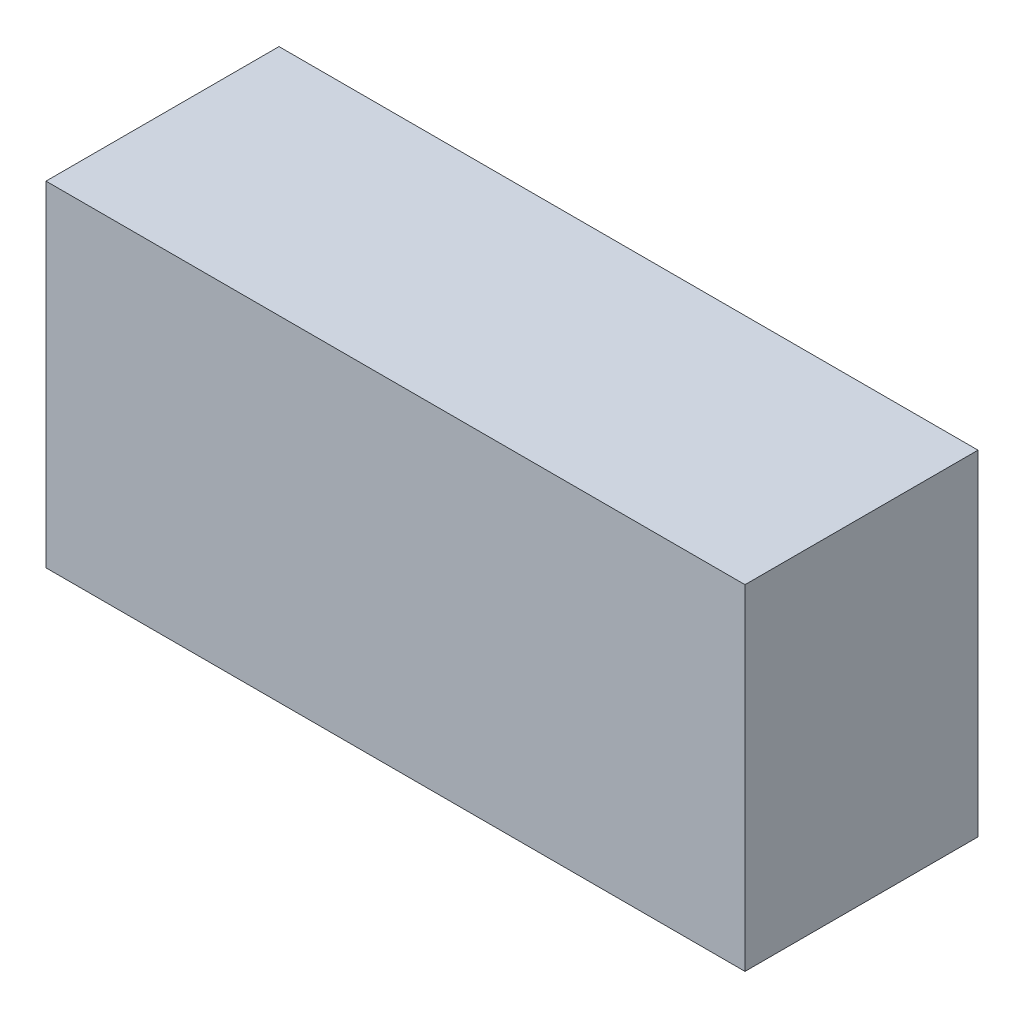
from build123d import *

# Parameters (mm, degrees)
SKETCH_1_W          = 480
SKETCH_1_H          = 230
EXTRUDE_1_DEPTH     = 160
CUT_EXTRUDE_1_DEPTH = 5


with BuildPart() as part:
    # 스케치1 → 보스-돌출1 (new body)
    with BuildSketch(Plane.XY):
        Rectangle(SKETCH_1_W, SKETCH_1_H)
    extrude(amount=EXTRUDE_1_DEPTH)

    # 스케치3 → 컷-돌출1 (cut)
    # profile 1 of 8: a face of its own
    with BuildSketch(Plane(origin=(0, -115, 0), x_dir=(-1, 0, 0), z_dir=(0, -1, 0))):
        with BuildLine():
            add(Edge.make_bspline(
                [(-65.042999138, -97.573485167), (-64.672667104, -97.582865049), (-63.945304436, -97.601287911), (-62.87630502, -97.74231136), (-61.855761619, -97.986285017), (-60.875360826, -98.311216346), (-59.946829531, -98.744669976), (-59.063178717, -99.26858511), (-58.226510866, -99.888450588), (-57.448102972, -100.599474742), (-56.735777542, -101.373094478), (-56.108201049, -102.198682536), (-55.582245085, -103.071247121), (-55.150326301, -103.988166153), (-54.811477102, -104.94736597), (-54.577653996, -105.953960271), (-54.428293138, -107.001427072), (-54.410831552, -107.715866299), (-54.401973497, -108.078292859)],
                knots=[0, 0, 0, 0, 1.065120563, 2.091984664, 3.0946048, 4.079830382, 5.057816894, 6.036188127, 7.030412546, 8.04752943, 9.064399622, 10.05169764, 11.02544977, 11.989514704, 12.962713494, 13.945757189, 14.957906945, 16, 16, 16, 16], degree=3))
            add(Edge.make_bspline(
                [(-54.401973497, -108.078292859), (-54.410830254, -108.438049696), (-54.428287949, -109.147172098), (-54.577823821, -110.187991779), (-54.81234382, -111.188510045), (-55.147179627, -112.147056632), (-55.577039504, -113.064642711), (-56.106497625, -113.938853876), (-56.730161686, -114.769976724), (-57.439915121, -115.548906239), (-58.213635361, -116.2631775), (-59.0435226, -116.885571076), (-59.910912999, -117.421137502), (-60.826968475, -117.848472782), (-61.779540114, -118.190026613), (-62.777153388, -118.422898784), (-63.815133697, -118.57311046), (-64.522968005, -118.590359123), (-64.882742728, -118.599126193)],
                knots=[0, 0, 0, 0, 1.043624062, 2.057103931, 3.04512605, 4.022047818, 4.998200453, 5.980619268, 6.982898556, 8.009068085, 9.034988726, 10.034168286, 11.015286542, 11.987931943, 12.962482838, 13.94673481, 14.956375938, 16, 16, 16, 16], degree=3))
            add(Edge.make_bspline(
                [(-64.882742728, -118.599126193), (-65.245167408, -118.590272553), (-65.959602927, -118.572819674), (-67.008385987, -118.423211646), (-68.01568738, -118.189261339), (-68.97862653, -117.854921703), (-69.897740413, -117.422823242), (-70.7748266, -116.895941076), (-71.606364584, -116.270757412), (-72.385460279, -115.561234129), (-73.09831284, -114.78882526), (-73.719794986, -113.961200945), (-74.246795634, -113.094598336), (-74.677443248, -112.186612484), (-75.018383016, -111.241632811), (-75.250981977, -110.253355797), (-75.401473131, -109.227415764), (-75.418815111, -108.528884916), (-75.427614523, -108.174446705)],
                knots=[0, 0, 0, 0, 1.053102029, 2.075944431, 3.073151272, 4.055350789, 5.033113405, 6.020478099, 7.024410459, 8.052272461, 9.079885166, 10.07527673, 11.055994387, 12.023226415, 12.992069828, 13.970394897, 14.97016774, 16, 16, 16, 16], degree=3))
            add(Edge.make_bspline(
                [(-75.427614523, -108.174446705), (-75.424559463, -107.936545739), (-75.418487884, -107.463745033), (-75.345392498, -106.761650175), (-75.239325634, -106.070846416), (-75.087314705, -105.393298142), (-74.888505179, -104.730663944), (-74.653922166, -104.078373871), (-74.367408764, -103.443038306), (-74.043519346, -102.821647497), (-73.682023301, -102.223888035), (-73.282733304, -101.658861845), (-72.859674055, -101.121827578), (-72.395883235, -100.626701842), (-71.906646405, -100.159080948), (-71.384027101, -99.726151137), (-70.831214276, -99.32400856), (-70.245829249, -98.961606611), (-69.64229625, -98.633840127), (-69.020143234, -98.352572407), (-68.387819968, -98.111166341), (-67.742364837, -97.915504483), (-67.085491854, -97.761035706), (-66.415767371, -97.655850828), (-65.733724935, -97.582569011), (-65.274231684, -97.576526143), (-65.042999138, -97.573485167)],
                knots=[0, 0, 0, 0, 1.037015668, 2.060948919, 3.074880161, 4.083647147, 5.086022904, 6.090072063, 7.104153813, 8.122640571, 9.144368836, 10.147691507, 11.138137339, 12.123020368, 13.103399296, 14.087645067, 15.080126199, 16.082011238, 17.087798457, 18.072939717, 19.057185487, 20.037253025, 21.01195951, 21.997135196, 22.992090687, 24, 24, 24, 24], degree=3))
        make_face()
        with BuildLine():
            add(Edge.make_bspline(
                [(-64.954858112, -99.624767218), (-65.144656018, -99.627080877), (-65.522437349, -99.631686075), (-66.084063271, -99.692347307), (-66.638302893, -99.778803815), (-67.185270677, -99.902126791), (-67.722678044, -100.07014995), (-68.25553428, -100.263526568), (-68.778980302, -100.499075657), (-69.291288061, -100.765205397), (-69.787945633, -101.059770658), (-70.256589642, -101.385323613), (-70.698433321, -101.734229637), (-71.112394845, -102.107302994), (-71.497258686, -102.506443575), (-71.860599837, -102.925600353), (-72.18785459, -103.376754016), (-72.487772171, -103.847670627), (-72.75615983, -104.337736805), (-72.994819, -104.841793161), (-73.190041907, -105.363951371), (-73.349255486, -105.898546557), (-73.481254405, -106.444732041), (-73.564876829, -107.006651177), (-73.626204597, -107.581480389), (-73.630546571, -107.969948126), (-73.632742728, -108.166433885)],
                knots=[0, 0, 0, 0, 1.008559885, 2.007477868, 2.99961109, 3.989939068, 4.984837346, 5.991145699, 7.001802488, 8.033829008, 9.059044045, 10.069351652, 11.065060232, 12.050310815, 13.029377138, 14.011219647, 14.996725999, 15.989392538, 16.977580475, 17.965360261, 18.951710183, 19.937753436, 20.929683414, 21.935841486, 22.955955122, 24, 24, 24, 24], degree=3))
            add(Edge.make_bspline(
                [(-73.632742728, -108.166433885), (-73.625457802, -108.455360861), (-73.6111261, -109.023769605), (-73.485654271, -109.856730427), (-73.292385846, -110.657234921), (-73.007486609, -111.420902974), (-72.651197382, -112.154298876), (-72.211043724, -112.850916617), (-71.689563235, -113.51094447), (-71.097200225, -114.129774579), (-70.449641902, -114.694607746), (-69.762026302, -115.190398652), (-69.041719974, -115.609885794), (-68.28684453, -115.951629065), (-67.501430021, -116.222427567), (-66.680415444, -116.408019745), (-65.82926996, -116.530165204), (-65.249094788, -116.541895238), (-64.954858112, -116.547844141)],
                knots=[0, 0, 0, 0, 1.032063989, 2.030389145, 3.003944642, 3.970395727, 4.937377036, 5.913328081, 6.909231446, 7.93887556, 8.970685674, 9.976071282, 10.964166581, 11.944589148, 12.933237628, 13.927779006, 14.949070134, 16, 16, 16, 16], degree=3))
            add(Edge.make_bspline(
                [(-64.954858112, -116.547844141), (-64.757089532, -116.545126973), (-64.364855038, -116.539738014), (-63.781452053, -116.48545986), (-63.208559415, -116.398420606), (-62.646980673, -116.273102574), (-62.097353179, -116.116261395), (-61.557382876, -115.929931521), (-61.032821217, -115.6974675), (-60.517050715, -115.440622062), (-60.023357905, -115.147821162), (-59.552069149, -114.83331745), (-59.11506355, -114.484925331), (-58.701411713, -114.117394974), (-58.314967776, -113.723315843), (-57.958345009, -113.30320029), (-57.632744254, -112.854396534), (-57.332940559, -112.384194216), (-57.065493344, -111.892787058), (-56.83246992, -111.386903184), (-56.63477783, -110.867788273), (-56.475186374, -110.334693579), (-56.350126593, -109.788631586), (-56.263955622, -109.228871139), (-56.20367883, -108.656532039), (-56.199135531, -108.269424291), (-56.196845292, -108.074286449)],
                knots=[0, 0, 0, 0, 1.047197238, 2.076906641, 3.100256066, 4.114471768, 5.12198147, 6.126382909, 7.136867548, 8.15857795, 9.17633901, 10.174870724, 11.156907918, 12.133735059, 13.104061851, 14.077631395, 15.04955518, 16.038496417, 17.029181396, 18.010275684, 18.986308667, 19.968651475, 20.955262928, 21.950658345, 22.966943676, 24, 24, 24, 24], degree=3))
            add(Edge.make_bspline(
                [(-56.196845292, -108.074286449), (-56.199137366, -107.880483567), (-56.203684117, -107.496039852), (-56.26392683, -106.927692319), (-56.350217632, -106.371959682), (-56.474575963, -105.831023665), (-56.634862556, -105.304746378), (-56.832504444, -104.793622106), (-57.065563298, -104.295746705), (-57.333038866, -103.812350723), (-57.633700714, -103.348495077), (-57.962239248, -102.90505272), (-58.324326951, -102.490351341), (-58.709618522, -102.094153089), (-59.127737867, -101.724908006), (-59.576790976, -101.382493602), (-60.051326277, -101.05864632), (-60.553767623, -100.766500252), (-61.072304501, -100.496704637), (-61.604384261, -100.265556048), (-62.143979116, -100.069143937), (-62.689716901, -99.901618422), (-63.246191063, -99.779286821), (-63.809641513, -99.692269394), (-64.379288705, -99.631707189), (-64.762392818, -99.627087883), (-64.954858112, -99.624767218)],
                knots=[0, 0, 0, 0, 1.02996197, 2.043119294, 3.035359645, 4.018872909, 4.991431989, 5.957985074, 6.929999688, 7.912076566, 8.892894881, 9.867085534, 10.843653904, 11.817741046, 12.803660682, 13.806313499, 14.818574707, 15.856120519, 16.894564902, 17.924820532, 18.937903209, 19.946497019, 20.957711757, 21.963978472, 22.977135795, 24, 24, 24, 24], degree=3))
        make_face(mode=Mode.SUBTRACT)
    # profile 2 of 8: a face of its own
    with BuildSketch(Plane(origin=(0, -115, 0), x_dir=(-1, 0, 0), z_dir=(0, -1, 0))):
        Polygon((-51.32505042, -118.08630568), (-48.684826061, -98.08630568), (-48.428415805, -98.08630568), (-40.171204266, -114.49656209), (-31.934024779, -98.08630568), (-31.673608112, -98.08630568), (-29.017358112, -118.08630568), (-30.820242728, -118.08630568), (-32.73530683, -103.695280039), (-39.954858112, -118.08630568), (-40.359505548, -118.08630568), (-47.607101702, -103.663228757), (-49.518159394, -118.08630568), align=None)
    # profile 3 of 8: a face of its own
    with BuildSketch(Plane(origin=(0, -115, 0), x_dir=(-1, 0, 0), z_dir=(0, -1, 0))):
        with BuildLine():
            add(Edge.make_bspline(
                [(-15.555819651, -97.573485167), (-15.185487617, -97.582865049), (-14.458124949, -97.601287911), (-13.389125533, -97.74231136), (-12.368582132, -97.986285017), (-11.388181338, -98.311216346), (-10.459650044, -98.744669976), (-9.57599923, -99.26858511), (-8.739331379, -99.888450588), (-7.960923485, -100.599474742), (-7.248598054, -101.373094478), (-6.621021562, -102.198682536), (-6.095065597, -103.071247121), (-5.663146814, -103.988166153), (-5.324297615, -104.94736597), (-5.090474508, -105.953960271), (-4.94111365, -107.001427072), (-4.923652065, -107.715866299), (-4.91479401, -108.078292859)],
                knots=[0, 0, 0, 0, 1.065120563, 2.091984664, 3.0946048, 4.079830382, 5.057816894, 6.036188127, 7.030412546, 8.04752943, 9.064399622, 10.05169764, 11.02544977, 11.989514704, 12.962713494, 13.945757189, 14.957906945, 16, 16, 16, 16], degree=3))
            add(Edge.make_bspline(
                [(-4.91479401, -108.078292859), (-4.923650767, -108.438049696), (-4.941108462, -109.147172098), (-5.090644333, -110.187991779), (-5.325164333, -111.188510045), (-5.66000014, -112.147056632), (-6.089860017, -113.064642711), (-6.619318138, -113.938853876), (-7.242982199, -114.769976724), (-7.952735634, -115.548906239), (-8.726455874, -116.2631775), (-9.556343113, -116.885571076), (-10.423733512, -117.421137502), (-11.339788987, -117.848472782), (-12.292360626, -118.190026613), (-13.289973901, -118.422898784), (-14.32795421, -118.57311046), (-15.035788517, -118.590359123), (-15.395563241, -118.599126193)],
                knots=[0, 0, 0, 0, 1.043624062, 2.057103931, 3.04512605, 4.022047818, 4.998200453, 5.980619268, 6.982898556, 8.009068085, 9.034988726, 10.034168286, 11.015286542, 11.987931943, 12.962482838, 13.94673481, 14.956375938, 16, 16, 16, 16], degree=3))
            add(Edge.make_bspline(
                [(-15.395563241, -118.599126193), (-15.757987921, -118.590272553), (-16.47242344, -118.572819674), (-17.521206499, -118.423211646), (-18.528507893, -118.189261339), (-19.491447043, -117.854921703), (-20.410560926, -117.422823242), (-21.287647113, -116.895941076), (-22.119185097, -116.270757412), (-22.898280791, -115.561234129), (-23.611133352, -114.78882526), (-24.232615499, -113.961200945), (-24.759616147, -113.094598336), (-25.190263761, -112.186612484), (-25.531203529, -111.241632811), (-25.76380249, -110.253355797), (-25.914293644, -109.227415764), (-25.931635624, -108.528884916), (-25.940435036, -108.174446705)],
                knots=[0, 0, 0, 0, 1.053102029, 2.075944431, 3.073151272, 4.055350789, 5.033113405, 6.020478099, 7.024410459, 8.052272461, 9.079885166, 10.07527673, 11.055994387, 12.023226415, 12.992069828, 13.970394897, 14.97016774, 16, 16, 16, 16], degree=3))
            add(Edge.make_bspline(
                [(-25.940435036, -108.174446705), (-25.937379975, -107.936545739), (-25.931308396, -107.463745033), (-25.858213011, -106.761650175), (-25.752146147, -106.070846416), (-25.600135218, -105.393298142), (-25.401325692, -104.730663944), (-25.166742679, -104.078373871), (-24.880229277, -103.443038306), (-24.556339859, -102.821647497), (-24.194843813, -102.223888035), (-23.795553817, -101.658861845), (-23.372494568, -101.121827578), (-22.908703747, -100.626701842), (-22.419466918, -100.159080948), (-21.896847614, -99.726151137), (-21.344034789, -99.32400856), (-20.758649762, -98.961606611), (-20.155116763, -98.633840127), (-19.532963747, -98.352572407), (-18.900640481, -98.111166341), (-18.25518535, -97.915504483), (-17.598312367, -97.761035706), (-16.928587883, -97.655850828), (-16.246545448, -97.582569011), (-15.787052196, -97.576526143), (-15.555819651, -97.573485167)],
                knots=[0, 0, 0, 0, 1.037015668, 2.060948919, 3.074880161, 4.083647147, 5.086022904, 6.090072063, 7.104153813, 8.122640571, 9.144368836, 10.147691507, 11.138137339, 12.123020368, 13.103399296, 14.087645067, 15.080126199, 16.082011238, 17.087798457, 18.072939717, 19.057185487, 20.037253025, 21.01195951, 21.997135196, 22.992090687, 24, 24, 24, 24], degree=3))
        make_face()
        with BuildLine():
            add(Edge.make_bspline(
                [(-15.467678625, -99.624767218), (-15.657476531, -99.627080877), (-16.035257862, -99.631686075), (-16.596883784, -99.692347307), (-17.151123406, -99.778803815), (-17.698091189, -99.902126791), (-18.235498557, -100.07014995), (-18.768354793, -100.263526568), (-19.291800815, -100.499075657), (-19.804108574, -100.765205397), (-20.300766146, -101.059770658), (-20.769410154, -101.385323613), (-21.211253834, -101.734229637), (-21.625215358, -102.107302994), (-22.010079199, -102.506443575), (-22.37342035, -102.925600353), (-22.700675102, -103.376754016), (-23.000592684, -103.847670627), (-23.268980343, -104.337736805), (-23.507639513, -104.841793161), (-23.70286242, -105.363951371), (-23.862075999, -105.898546557), (-23.994074918, -106.444732041), (-24.077697342, -107.006651177), (-24.13902511, -107.581480389), (-24.143367084, -107.969948126), (-24.145563241, -108.166433885)],
                knots=[0, 0, 0, 0, 1.008559885, 2.007477868, 2.99961109, 3.989939068, 4.984837346, 5.991145699, 7.001802488, 8.033829008, 9.059044045, 10.069351652, 11.065060232, 12.050310815, 13.029377138, 14.011219647, 14.996725999, 15.989392538, 16.977580475, 17.965360261, 18.951710183, 19.937753436, 20.929683414, 21.935841486, 22.955955122, 24, 24, 24, 24], degree=3))
            add(Edge.make_bspline(
                [(-24.145563241, -108.166433885), (-24.138278315, -108.455360861), (-24.123946613, -109.023769605), (-23.998474784, -109.856730427), (-23.805206358, -110.657234921), (-23.520307122, -111.420902974), (-23.164017895, -112.154298876), (-22.723864236, -112.850916617), (-22.202383747, -113.51094447), (-21.610020738, -114.129774579), (-20.962462415, -114.694607746), (-20.274846815, -115.190398652), (-19.554540487, -115.609885794), (-18.799665043, -115.951629065), (-18.014250534, -116.222427567), (-17.193235957, -116.408019745), (-16.342090473, -116.530165204), (-15.761915301, -116.541895238), (-15.467678625, -116.547844141)],
                knots=[0, 0, 0, 0, 1.032063989, 2.030389145, 3.003944642, 3.970395727, 4.937377036, 5.913328081, 6.909231446, 7.93887556, 8.970685674, 9.976071282, 10.964166581, 11.944589148, 12.933237628, 13.927779006, 14.949070134, 16, 16, 16, 16], degree=3))
            add(Edge.make_bspline(
                [(-15.467678625, -116.547844141), (-15.269910045, -116.545126973), (-14.877675551, -116.539738014), (-14.294272566, -116.48545986), (-13.721379928, -116.398420606), (-13.159801186, -116.273102574), (-12.610173692, -116.116261395), (-12.070203388, -115.929931521), (-11.545641729, -115.6974675), (-11.029871228, -115.440622062), (-10.536178418, -115.147821162), (-10.064889662, -114.83331745), (-9.627884063, -114.484925331), (-9.214232226, -114.117394974), (-8.827788289, -113.723315843), (-8.471165522, -113.30320029), (-8.145564767, -112.854396534), (-7.845761072, -112.384194216), (-7.578313856, -111.892787058), (-7.345290433, -111.386903184), (-7.147598343, -110.867788273), (-6.988006887, -110.334693579), (-6.862947106, -109.788631586), (-6.776776135, -109.228871139), (-6.716499342, -108.656532039), (-6.711956044, -108.269424291), (-6.709665805, -108.074286449)],
                knots=[0, 0, 0, 0, 1.047197238, 2.076906641, 3.100256066, 4.114471768, 5.12198147, 6.126382909, 7.136867548, 8.15857795, 9.17633901, 10.174870724, 11.156907918, 12.133735059, 13.104061851, 14.077631395, 15.04955518, 16.038496417, 17.029181396, 18.010275684, 18.986308667, 19.968651475, 20.955262928, 21.950658345, 22.966943676, 24, 24, 24, 24], degree=3))
            add(Edge.make_bspline(
                [(-6.709665805, -108.074286449), (-6.711957879, -107.880483567), (-6.71650463, -107.496039852), (-6.776747342, -106.927692319), (-6.863038144, -106.371959682), (-6.987396476, -105.831023665), (-7.147683069, -105.304746378), (-7.345324957, -104.793622106), (-7.578383811, -104.295746705), (-7.845859379, -103.812350723), (-8.146521227, -103.348495077), (-8.475059761, -102.90505272), (-8.837147464, -102.490351341), (-9.222439035, -102.094153089), (-9.64055838, -101.724908006), (-10.089611489, -101.382493602), (-10.56414679, -101.05864632), (-11.066588135, -100.766500252), (-11.585125014, -100.496704637), (-12.117204774, -100.265556048), (-12.656799629, -100.069143937), (-13.202537413, -99.901618422), (-13.759011575, -99.779286821), (-14.322462026, -99.692269394), (-14.892109218, -99.631707189), (-15.275213331, -99.627087883), (-15.467678625, -99.624767218)],
                knots=[0, 0, 0, 0, 1.02996197, 2.043119294, 3.035359645, 4.018872909, 4.991431989, 5.957985074, 6.929999688, 7.912076566, 8.892894881, 9.867085534, 10.843653904, 11.817741046, 12.803660682, 13.806313499, 14.818574707, 15.856120519, 16.894564902, 17.924820532, 18.937903209, 19.946497019, 20.957711757, 21.963978472, 22.977135795, 24, 24, 24, 24], degree=3))
        make_face(mode=Mode.SUBTRACT)
    # profile 4 of 8: a face of its own
    with BuildSketch(Plane(origin=(0, -115, 0), x_dir=(-1, 0, 0), z_dir=(0, -1, 0))):
        with BuildLine():
            Line((-0.812229907, -98.08630568), (3.190173939, -98.08630568))
            add(Edge.make_bspline(
                [(3.190173939, -98.08630568), (3.457266102, -98.087194743), (3.970112641, -98.088901842), (4.704817043, -98.098420487), (5.372400455, -98.125702519), (5.972513822, -98.149180139), (6.505146136, -98.191991233), (6.971930655, -98.232909216), (7.370717498, -98.286472992), (7.612122362, -98.336218266), (7.721423939, -98.358741577)],
                knots=[0, 0, 0, 0, 1.410062039, 2.707475311, 3.878576406, 4.937260626, 5.877586885, 6.699081471, 7.410979367, 8, 8, 8, 8], degree=3))
            add(Edge.make_bspline(
                [(7.721423939, -98.358741577), (7.867747505, -98.394894522), (8.157273159, -98.466429172), (8.57413068, -98.617626891), (8.971355388, -98.792596174), (9.347297241, -98.998103147), (9.700073191, -99.235673317), (10.033320681, -99.501205445), (10.3485519, -99.793246621), (10.633018359, -100.119160001), (10.901241511, -100.461082913), (11.127462234, -100.830818667), (11.32247069, -101.217455967), (11.477730787, -101.624926926), (11.602747778, -102.049279908), (11.690897717, -102.494358746), (11.743761647, -102.958135747), (11.749143678, -103.274466654), (11.751872657, -103.434863372)],
                knots=[0, 0, 0, 0, 1.027469482, 2.033020251, 3.019912614, 3.986113645, 4.951240523, 5.91722682, 6.890402269, 7.87763091, 8.8651537, 9.85103654, 10.82876324, 11.815024772, 12.821070561, 13.842952187, 14.906261191, 16, 16, 16, 16], degree=3))
            add(Edge.make_bspline(
                [(11.751872657, -103.434863372), (11.743478382, -103.701349684), (11.727098977, -104.221333501), (11.574384099, -104.975967109), (11.324232558, -105.679906049), (10.979528049, -106.33226398), (10.540559617, -106.920324811), (10.012989382, -107.436841698), (9.39652303, -107.86906977), (8.822641225, -108.168800083), (8.315702941, -108.360759561), (7.898369725, -108.495824469), (7.443129854, -108.600178556), (6.954345085, -108.693665023), (6.429981339, -108.764246134), (5.871295399, -108.81594096), (5.277888819, -108.848249809), (4.870236994, -108.853061266), (4.660526503, -108.855536449)],
                knots=[0, 0, 0, 0, 1.260483769, 2.459530307, 3.627416485, 4.787058657, 5.939039949, 7.08810263, 8.267026773, 9.491475466, 10.141966685, 10.831826277, 11.566392101, 12.351337768, 13.187381173, 14.07005841, 15.007169909, 16, 16, 16, 16], degree=3))
            Line((4.660526503, -108.855536449), (12.008282913, -118.08630568))
            Line((12.008282913, -118.08630568), (9.788731631, -118.08630568))
            Line((9.788731631, -118.08630568), (2.440975221, -108.855536449))
            Line((2.440975221, -108.855536449), (0.982641888, -108.855536449))
            Line((0.982641888, -108.855536449), (0.982641888, -118.08630568))
            Line((0.982641888, -118.08630568), (-0.812229907, -118.08630568))
            Line((-0.812229907, -118.08630568), (-0.812229907, -98.08630568))
        make_face()
        with BuildLine():
            Line((0.982641888, -100.137587731), (0.982641888, -106.804254398))
            Line((0.982641888, -106.804254398), (4.644500862, -106.832299269))
            add(Edge.make_bspline(
                [(4.644500862, -106.832299269), (4.815472513, -106.832374908), (5.146864268, -106.832521516), (5.626296638, -106.809699937), (6.072697276, -106.783738118), (6.484358717, -106.744027573), (6.861464862, -106.69285002), (7.203827223, -106.628832967), (7.512004663, -106.554249752), (7.871424882, -106.43881189), (8.27277649, -106.255920357), (8.708956261, -105.989831793), (9.080398191, -105.655151112), (9.394214547, -105.272445649), (9.646382727, -104.851667084), (9.824165894, -104.39785926), (9.93697985, -103.9224787), (9.950285824, -103.595746655), (9.957000862, -103.430856962)],
                knots=[0, 0, 0, 0, 1.146690395, 2.22261258, 3.21895312, 4.145990853, 4.996080663, 5.770904154, 6.481378293, 7.121626537, 8.300444488, 9.431385265, 10.535395872, 11.636531494, 12.74115979, 13.810798291, 14.895190096, 16, 16, 16, 16], degree=3))
            add(Edge.make_bspline(
                [(9.957000862, -103.430856962), (9.950131599, -103.270019398), (9.936519225, -102.951298034), (9.825383405, -102.484692832), (9.637444083, -102.04431026), (9.384174152, -101.631941774), (9.075607552, -101.257623284), (8.71379148, -100.937353838), (8.308618936, -100.673071182), (7.929926374, -100.504189008), (7.59144516, -100.400646989), (7.297561388, -100.327783196), (6.965495801, -100.269243374), (6.593636037, -100.222340169), (6.183569576, -100.182026202), (5.733222998, -100.154873181), (5.245584254, -100.138793957), (4.90760179, -100.137999164), (4.732641888, -100.137587731)],
                knots=[0, 0, 0, 0, 1.101028733, 2.181837193, 3.264309656, 4.369019818, 5.486613113, 6.575447106, 7.666700264, 8.788928104, 9.402425223, 10.0903467, 10.862060571, 11.710948788, 12.657782767, 13.684531032, 14.801375019, 16, 16, 16, 16], degree=3))
            Line((4.732641888, -100.137587731), (0.982641888, -100.137587731))
        make_face(mode=Mode.SUBTRACT)
    # profile 5 of 8: a face of its own
    with BuildSketch(Plane(origin=(0, -115, 0), x_dir=(-1, 0, 0), z_dir=(0, -1, 0))):
        with BuildLine():
            add(Edge.make_bspline(
                [(25.469821375, -97.573485167), (25.840153408, -97.582865049), (26.567516077, -97.601287911), (27.636515492, -97.74231136), (28.657058894, -97.986285017), (29.637459687, -98.311216346), (30.565990982, -98.744669976), (31.449641796, -99.26858511), (32.286309647, -99.888450588), (33.064717541, -100.599474742), (33.777042971, -101.373094478), (34.404619464, -102.198682536), (34.930575428, -103.071247121), (35.362494212, -103.988166153), (35.70134341, -104.94736597), (35.935166517, -105.953960271), (36.084527375, -107.001427072), (36.10198896, -107.715866299), (36.110847016, -108.078292859)],
                knots=[0, 0, 0, 0, 1.065120563, 2.091984664, 3.0946048, 4.079830382, 5.057816894, 6.036188127, 7.030412546, 8.04752943, 9.064399622, 10.05169764, 11.02544977, 11.989514704, 12.962713494, 13.945757189, 14.957906945, 16, 16, 16, 16], degree=3))
            add(Edge.make_bspline(
                [(36.110847016, -108.078292859), (36.101990258, -108.438049696), (36.084532564, -109.147172098), (35.934996692, -110.187991779), (35.700476692, -111.188510045), (35.365640886, -112.147056632), (34.935781009, -113.064642711), (34.406322888, -113.938853876), (33.782658827, -114.769976724), (33.072905392, -115.548906239), (32.299185152, -116.2631775), (31.469297913, -116.885571076), (30.601907513, -117.421137502), (29.685852038, -117.848472782), (28.733280399, -118.190026613), (27.735667125, -118.422898784), (26.697686816, -118.57311046), (25.989852508, -118.590359123), (25.630077785, -118.599126193)],
                knots=[0, 0, 0, 0, 1.043624062, 2.057103931, 3.04512605, 4.022047818, 4.998200453, 5.980619268, 6.982898556, 8.009068085, 9.034988726, 10.034168286, 11.015286542, 11.987931943, 12.962482838, 13.94673481, 14.956375938, 16, 16, 16, 16], degree=3))
            add(Edge.make_bspline(
                [(25.630077785, -118.599126193), (25.267653105, -118.590272553), (24.553217585, -118.572819674), (23.504434526, -118.423211646), (22.497133133, -118.189261339), (21.534193983, -117.854921703), (20.6150801, -117.422823242), (19.737993913, -116.895941076), (18.906455928, -116.270757412), (18.127360234, -115.561234129), (17.414507673, -114.78882526), (16.793025526, -113.961200945), (16.266024879, -113.094598336), (15.835377265, -112.186612484), (15.494437497, -111.241632811), (15.261838536, -110.253355797), (15.111347381, -109.227415764), (15.094005402, -108.528884916), (15.08520599, -108.174446705)],
                knots=[0, 0, 0, 0, 1.053102029, 2.075944431, 3.073151272, 4.055350789, 5.033113405, 6.020478099, 7.024410459, 8.052272461, 9.079885166, 10.07527673, 11.055994387, 12.023226415, 12.992069828, 13.970394897, 14.97016774, 16, 16, 16, 16], degree=3))
            add(Edge.make_bspline(
                [(15.08520599, -108.174446705), (15.08826105, -107.936545739), (15.094332629, -107.463745033), (15.167428015, -106.761650175), (15.273494879, -106.070846416), (15.425505808, -105.393298142), (15.624315333, -104.730663944), (15.858898347, -104.078373871), (16.145411749, -103.443038306), (16.469301166, -102.821647497), (16.830797212, -102.223888035), (17.230087209, -101.658861845), (17.653146457, -101.121827578), (18.116937278, -100.626701842), (18.606174108, -100.159080948), (19.128793412, -99.726151137), (19.681606236, -99.32400856), (20.266991264, -98.961606611), (20.870524263, -98.633840127), (21.492677279, -98.352572407), (22.125000545, -98.111166341), (22.770455676, -97.915504483), (23.427328659, -97.761035706), (24.097053142, -97.655850828), (24.779095578, -97.582569011), (25.238588829, -97.576526143), (25.469821375, -97.573485167)],
                knots=[0, 0, 0, 0, 1.037015668, 2.060948919, 3.074880161, 4.083647147, 5.086022904, 6.090072063, 7.104153813, 8.122640571, 9.144368836, 10.147691507, 11.138137339, 12.123020368, 13.103399296, 14.087645067, 15.080126199, 16.082011238, 17.087798457, 18.072939717, 19.057185487, 20.037253025, 21.01195951, 21.997135196, 22.992090687, 24, 24, 24, 24], degree=3))
        make_face()
        with BuildLine():
            add(Edge.make_bspline(
                [(25.5579624, -99.624767218), (25.368164494, -99.627080877), (24.990383163, -99.631686075), (24.428757242, -99.692347307), (23.87451762, -99.778803815), (23.327549836, -99.902126791), (22.790142468, -100.07014995), (22.257286233, -100.263526568), (21.733840211, -100.499075657), (21.221532452, -100.765205397), (20.72487488, -101.059770658), (20.256230871, -101.385323613), (19.814387191, -101.734229637), (19.400425668, -102.107302994), (19.015561827, -102.506443575), (18.652220676, -102.925600353), (18.324965923, -103.376754016), (18.025048341, -103.847670627), (17.756660683, -104.337736805), (17.518001513, -104.841793161), (17.322778605, -105.363951371), (17.163565027, -105.898546557), (17.031566107, -106.444732041), (16.947943684, -107.006651177), (16.886615916, -107.581480389), (16.882273942, -107.969948126), (16.880077785, -108.166433885)],
                knots=[0, 0, 0, 0, 1.008559885, 2.007477868, 2.99961109, 3.989939068, 4.984837346, 5.991145699, 7.001802488, 8.033829008, 9.059044045, 10.069351652, 11.065060232, 12.050310815, 13.029377138, 14.011219647, 14.996725999, 15.989392538, 16.977580475, 17.965360261, 18.951710183, 19.937753436, 20.929683414, 21.935841486, 22.955955122, 24, 24, 24, 24], degree=3))
            add(Edge.make_bspline(
                [(16.880077785, -108.166433885), (16.88736271, -108.455360861), (16.901694413, -109.023769605), (17.027166242, -109.856730427), (17.220434667, -110.657234921), (17.505333904, -111.420902974), (17.861623131, -112.154298876), (18.301776789, -112.850916617), (18.823257278, -113.51094447), (19.415620287, -114.129774579), (20.063178611, -114.694607746), (20.75079421, -115.190398652), (21.471100539, -115.609885794), (22.225975983, -115.951629065), (23.011390492, -116.222427567), (23.832405069, -116.408019745), (24.683550552, -116.530165204), (25.263725725, -116.541895238), (25.5579624, -116.547844141)],
                knots=[0, 0, 0, 0, 1.032063989, 2.030389145, 3.003944642, 3.970395727, 4.937377036, 5.913328081, 6.909231446, 7.93887556, 8.970685674, 9.976071282, 10.964166581, 11.944589148, 12.933237628, 13.927779006, 14.949070134, 16, 16, 16, 16], degree=3))
            add(Edge.make_bspline(
                [(25.5579624, -116.547844141), (25.755730981, -116.545126973), (26.147965475, -116.539738014), (26.731368459, -116.48545986), (27.304261098, -116.398420606), (27.86583984, -116.273102574), (28.415467334, -116.116261395), (28.955437637, -115.929931521), (29.479999296, -115.6974675), (29.995769798, -115.440622062), (30.489462608, -115.147821162), (30.960751364, -114.83331745), (31.397756963, -114.484925331), (31.811408799, -114.117394974), (32.197852737, -113.723315843), (32.554475504, -113.30320029), (32.880076259, -112.854396534), (33.179879954, -112.384194216), (33.447327169, -111.892787058), (33.680350592, -111.386903184), (33.878042683, -110.867788273), (34.037634139, -110.334693579), (34.16269392, -109.788631586), (34.248864891, -109.228871139), (34.309141683, -108.656532039), (34.313684982, -108.269424291), (34.315975221, -108.074286449)],
                knots=[0, 0, 0, 0, 1.047197238, 2.076906641, 3.100256066, 4.114471768, 5.12198147, 6.126382909, 7.136867548, 8.15857795, 9.17633901, 10.174870724, 11.156907918, 12.133735059, 13.104061851, 14.077631395, 15.04955518, 16.038496417, 17.029181396, 18.010275684, 18.986308667, 19.968651475, 20.955262928, 21.950658345, 22.966943676, 24, 24, 24, 24], degree=3))
            add(Edge.make_bspline(
                [(34.315975221, -108.074286449), (34.313683147, -107.880483567), (34.309136395, -107.496039852), (34.248893683, -106.927692319), (34.162602881, -106.371959682), (34.03824455, -105.831023665), (33.877957957, -105.304746378), (33.680316069, -104.793622106), (33.447257215, -104.295746705), (33.179781647, -103.812350723), (32.879119798, -103.348495077), (32.550581265, -102.90505272), (32.188493561, -102.490351341), (31.803201991, -102.094153089), (31.385082646, -101.724908006), (30.936029537, -101.382493602), (30.461494236, -101.05864632), (29.95905289, -100.766500252), (29.440516012, -100.496704637), (28.908436252, -100.265556048), (28.368841397, -100.069143937), (27.823103612, -99.901618422), (27.26662945, -99.779286821), (26.703179, -99.692269394), (26.133531808, -99.631707189), (25.750427695, -99.627087883), (25.5579624, -99.624767218)],
                knots=[0, 0, 0, 0, 1.02996197, 2.043119294, 3.035359645, 4.018872909, 4.991431989, 5.957985074, 6.929999688, 7.912076566, 8.892894881, 9.867085534, 10.843653904, 11.817741046, 12.803660682, 13.806313499, 14.818574707, 15.856120519, 16.894564902, 17.924820532, 18.937903209, 19.946497019, 20.957711757, 21.963978472, 22.977135795, 24, 24, 24, 24], degree=3))
        make_face(mode=Mode.SUBTRACT)
    # profile 6 of 8: a face of its own
    with BuildSketch(Plane(origin=(0, -115, 0), x_dir=(-1, 0, 0), z_dir=(0, -1, 0))):
        with BuildLine():
            Line((40.213411118, -98.08630568), (44.115654708, -98.08630568))
            add(Edge.make_bspline(
                [(44.115654708, -98.08630568), (44.306674583, -98.087309968), (44.676918642, -98.089256528), (45.215315453, -98.119445849), (45.719594371, -98.160609677), (46.189901641, -98.225924492), (46.626019941, -98.304734647), (47.029263582, -98.400173596), (47.398350281, -98.514611388), (47.838994489, -98.696590138), (48.341398265, -98.967008243), (48.885389081, -99.366600044), (49.350556163, -99.855356976), (49.751620833, -100.406686436), (50.070484373, -101.01317656), (50.301166072, -101.660371924), (50.447211074, -102.339924735), (50.462230699, -102.80645718), (50.469821375, -103.042235167)],
                knots=[0, 0, 0, 0, 1.001505555, 1.941167018, 2.826882275, 3.653841531, 4.429895133, 5.150066043, 5.825578002, 6.45369114, 7.647487171, 8.808567382, 9.977351308, 11.170798116, 12.373658725, 13.556498008, 14.765093433, 16, 16, 16, 16], degree=3))
            add(Edge.make_bspline(
                [(50.469821375, -103.042235167), (50.463574412, -103.263106914), (50.451298542, -103.697140725), (50.333911346, -104.331964207), (50.150136097, -104.936256886), (49.894677531, -105.507813374), (49.562666124, -106.033719735), (49.169190017, -106.518218398), (48.694465431, -106.940795866), (48.338789774, -107.177041024), (48.158122657, -107.297042859)],
                knots=[0, 0, 0, 0, 1.044552857, 2.05264487, 3.044412934, 4.028983338, 5.005914585, 5.980388656, 6.974128949, 8, 8, 8, 8], degree=3))
            add(Edge.make_bspline(
                [(48.158122657, -107.297042859), (48.3853251, -107.384271425), (48.820019657, -107.551161278), (49.418225442, -107.846221073), (49.933624556, -108.167147418), (50.370179676, -108.517615133), (50.743537704, -108.895379766), (51.069554513, -109.305980419), (51.347733794, -109.754773321), (51.586093357, -110.237079237), (51.772086249, -110.747973342), (51.911377131, -111.282663491), (51.991191126, -111.839232378), (52.002549076, -112.218005974), (52.008282913, -112.409222346)],
                knots=[0, 0, 0, 0, 1.27268992, 2.434971085, 3.483601985, 4.442670788, 5.356604649, 6.2567628, 7.179492994, 8.113709626, 9.066344395, 10.018646069, 10.999752585, 12, 12, 12, 12], degree=3))
            add(Edge.make_bspline(
                [(52.008282913, -112.409222346), (52.002700936, -112.604461616), (51.991718239, -112.988600348), (51.910689829, -113.552915402), (51.773494932, -114.092200812), (51.584516953, -114.609944713), (51.337875155, -115.105145481), (51.037715359, -115.578364132), (50.67982071, -116.024846022), (50.279461458, -116.449552439), (49.826534913, -116.83142551), (49.337873456, -117.171515262), (48.807323057, -117.451207046), (48.243597377, -117.68615574), (47.640372713, -117.865625446), (47.000357814, -117.991183011), (46.32410466, -118.075783222), (45.86004894, -118.082738679), (45.622064964, -118.08630568)],
                knots=[0, 0, 0, 0, 0.978564426, 1.925352924, 2.850884081, 3.763762016, 4.682927383, 5.618979971, 6.567305752, 7.547517671, 8.540179244, 9.531824382, 10.526200242, 11.540722885, 12.589160233, 13.674978461, 14.80764778, 16, 16, 16, 16], degree=3))
            Line((45.622064964, -118.08630568), (40.213411118, -118.08630568))
            Line((40.213411118, -118.08630568), (40.213411118, -98.08630568))
        make_face()
        with BuildLine():
            Line((42.008282913, -100.137587731), (42.008282913, -106.547844141))
            Line((42.008282913, -106.547844141), (43.2142124, -106.547844141))
            add(Edge.make_bspline(
                [(43.2142124, -106.547844141), (43.390491231, -106.545558867), (43.731097855, -106.541143251), (44.224354407, -106.528494582), (44.682211654, -106.493077191), (45.103879272, -106.45766998), (45.488693237, -106.400100907), (45.835801017, -106.331574491), (46.150650142, -106.259100747), (46.51373326, -106.135846536), (46.92557868, -105.953688392), (47.364624989, -105.670992186), (47.751679101, -105.334281596), (48.078520174, -104.945761815), (48.346014291, -104.517955039), (48.531806949, -104.05768715), (48.65779143, -103.576429253), (48.669171609, -103.246039237), (48.67494958, -103.078292859)],
                knots=[0, 0, 0, 0, 1.156816544, 2.235205308, 3.236616184, 4.169592532, 5.011045266, 5.787822928, 6.49130361, 7.128639758, 8.301311294, 9.436451833, 10.541879658, 11.654887649, 12.756523258, 13.837046038, 14.901820046, 16, 16, 16, 16], degree=3))
            add(Edge.make_bspline(
                [(48.67494958, -103.078292859), (48.671942836, -102.967288451), (48.666044779, -102.749541181), (48.617740193, -102.432116301), (48.535639768, -102.133580572), (48.430186664, -101.849842799), (48.282822728, -101.589775083), (48.109317223, -101.344385393), (47.899684708, -101.122030431), (47.661071492, -100.914204726), (47.386736505, -100.729950281), (47.076843408, -100.568574492), (46.72719954, -100.438627196), (46.343697511, -100.324820611), (45.920434154, -100.244887503), (45.462293849, -100.178296717), (44.965524026, -100.144395334), (44.621837726, -100.139907546), (44.444180349, -100.137587731)],
                knots=[0, 0, 0, 0, 0.91205012, 1.789085906, 2.630437955, 3.453916878, 4.269457761, 5.079663411, 5.91843418, 6.774407191, 7.675494373, 8.627863946, 9.638891023, 10.736472738, 11.911756761, 13.175263542, 14.539845004, 16, 16, 16, 16], degree=3))
            Line((44.444180349, -100.137587731), (42.008282913, -100.137587731))
        make_face(mode=Mode.SUBTRACT)
        with BuildLine():
            Line((42.008282913, -108.599126193), (42.008282913, -116.035023628))
            Line((42.008282913, -116.035023628), (44.564372657, -116.035023628))
            add(Edge.make_bspline(
                [(44.564372657, -116.035023628), (44.747337948, -116.032830786), (45.099979425, -116.028604372), (45.609129312, -116.014806917), (46.081032762, -115.983422485), (46.513536395, -115.934017629), (46.91131041, -115.880426491), (47.269582999, -115.808362029), (47.59125839, -115.72579654), (47.964254434, -115.598172699), (48.384274481, -115.399907151), (48.836907946, -115.100968714), (49.239343479, -114.744835527), (49.581087817, -114.332658874), (49.861162037, -113.884479863), (50.064907495, -113.409363578), (50.190569533, -112.915160564), (50.205781929, -112.578207921), (50.213411118, -112.409222346)],
                knots=[0, 0, 0, 0, 1.160039823, 2.235823828, 3.228722157, 4.157150951, 4.99529583, 5.772374946, 6.472645482, 7.099169577, 8.269452708, 9.405989375, 10.527446681, 11.663510218, 12.788923519, 13.866172445, 14.929861265, 16, 16, 16, 16], degree=3))
            add(Edge.make_bspline(
                [(50.213411118, -112.409222346), (50.211833379, -112.303546115), (50.20870335, -112.093898219), (50.161499836, -111.785807824), (50.092849152, -111.487374262), (50.004098101, -111.197787173), (49.874844003, -110.922282166), (49.72394946, -110.655410397), (49.547027165, -110.396819086), (49.271346218, -110.069891923), (48.870363449, -109.693223278), (48.300610446, -109.324437551), (47.652768744, -109.02702151), (47.182897356, -108.900738788), (46.940173939, -108.835504398)],
                knots=[0, 0, 0, 0, 0.723448775, 1.435228256, 2.130040452, 2.821711965, 3.505591119, 4.210454504, 4.921174351, 5.648778258, 7.137944449, 8.670945889, 10.280296675, 12, 12, 12, 12], degree=3))
            add(Edge.make_bspline(
                [(46.940173939, -108.835504398), (46.84286482, -108.815761061), (46.631878578, -108.772953434), (46.287835261, -108.727766558), (45.895058867, -108.687509072), (45.452642426, -108.657731029), (44.960026191, -108.62695078), (44.416158084, -108.614980373), (43.823259143, -108.600698887), (43.411874158, -108.599663834), (43.198186759, -108.599126193)],
                knots=[0, 0, 0, 0, 0.634451884, 1.375622551, 2.216452059, 3.157844607, 4.20941857, 5.370758133, 6.634282058, 8, 8, 8, 8], degree=3))
            Line((43.198186759, -108.599126193), (42.008282913, -108.599126193))
        make_face(mode=Mode.SUBTRACT)
    # profile 7 of 8: a face of its own
    with BuildSketch(Plane(origin=(0, -115, 0), x_dir=(-1, 0, 0), z_dir=(0, -1, 0))):
        with BuildLine():
            add(Edge.make_bspline(
                [(65.469821375, -97.573485167), (65.840153408, -97.582865049), (66.567516077, -97.601287911), (67.636515492, -97.74231136), (68.657058894, -97.986285017), (69.637459687, -98.311216346), (70.565990982, -98.744669976), (71.449641796, -99.26858511), (72.286309647, -99.888450588), (73.064717541, -100.599474742), (73.777042971, -101.373094478), (74.404619464, -102.198682536), (74.930575428, -103.071247121), (75.362494212, -103.988166153), (75.70134341, -104.94736597), (75.935166517, -105.953960271), (76.084527375, -107.001427072), (76.10198896, -107.715866299), (76.110847016, -108.078292859)],
                knots=[0, 0, 0, 0, 1.065120563, 2.091984664, 3.0946048, 4.079830382, 5.057816894, 6.036188127, 7.030412546, 8.04752943, 9.064399622, 10.05169764, 11.02544977, 11.989514704, 12.962713494, 13.945757189, 14.957906945, 16, 16, 16, 16], degree=3))
            add(Edge.make_bspline(
                [(76.110847016, -108.078292859), (76.101990258, -108.438049696), (76.084532564, -109.147172098), (75.934996692, -110.187991779), (75.700476692, -111.188510045), (75.365640886, -112.147056632), (74.935781009, -113.064642711), (74.406322888, -113.938853876), (73.782658827, -114.769976724), (73.072905392, -115.548906239), (72.299185152, -116.2631775), (71.469297913, -116.885571076), (70.601907513, -117.421137502), (69.685852038, -117.848472782), (68.733280399, -118.190026613), (67.735667125, -118.422898784), (66.697686816, -118.57311046), (65.989852508, -118.590359123), (65.630077785, -118.599126193)],
                knots=[0, 0, 0, 0, 1.043624062, 2.057103931, 3.04512605, 4.022047818, 4.998200453, 5.980619268, 6.982898556, 8.009068085, 9.034988726, 10.034168286, 11.015286542, 11.987931943, 12.962482838, 13.94673481, 14.956375938, 16, 16, 16, 16], degree=3))
            add(Edge.make_bspline(
                [(65.630077785, -118.599126193), (65.267653105, -118.590272553), (64.553217585, -118.572819674), (63.504434526, -118.423211646), (62.497133133, -118.189261339), (61.534193983, -117.854921703), (60.6150801, -117.422823242), (59.737993913, -116.895941076), (58.906455928, -116.270757412), (58.127360234, -115.561234129), (57.414507673, -114.78882526), (56.793025526, -113.961200945), (56.266024879, -113.094598336), (55.835377265, -112.186612484), (55.494437497, -111.241632811), (55.261838536, -110.253355797), (55.111347381, -109.227415764), (55.094005402, -108.528884916), (55.08520599, -108.174446705)],
                knots=[0, 0, 0, 0, 1.053102029, 2.075944431, 3.073151272, 4.055350789, 5.033113405, 6.020478099, 7.024410459, 8.052272461, 9.079885166, 10.07527673, 11.055994387, 12.023226415, 12.992069828, 13.970394897, 14.97016774, 16, 16, 16, 16], degree=3))
            add(Edge.make_bspline(
                [(55.08520599, -108.174446705), (55.08826105, -107.936545739), (55.094332629, -107.463745033), (55.167428015, -106.761650175), (55.273494879, -106.070846416), (55.425505808, -105.393298142), (55.624315333, -104.730663944), (55.858898347, -104.078373871), (56.145411749, -103.443038306), (56.469301166, -102.821647497), (56.830797212, -102.223888035), (57.230087209, -101.658861845), (57.653146457, -101.121827578), (58.116937278, -100.626701842), (58.606174108, -100.159080948), (59.128793412, -99.726151137), (59.681606236, -99.32400856), (60.266991264, -98.961606611), (60.870524263, -98.633840127), (61.492677279, -98.352572407), (62.125000545, -98.111166341), (62.770455676, -97.915504483), (63.427328659, -97.761035706), (64.097053142, -97.655850828), (64.779095578, -97.582569011), (65.238588829, -97.576526143), (65.469821375, -97.573485167)],
                knots=[0, 0, 0, 0, 1.037015668, 2.060948919, 3.074880161, 4.083647147, 5.086022904, 6.090072063, 7.104153813, 8.122640571, 9.144368836, 10.147691507, 11.138137339, 12.123020368, 13.103399296, 14.087645067, 15.080126199, 16.082011238, 17.087798457, 18.072939717, 19.057185487, 20.037253025, 21.01195951, 21.997135196, 22.992090687, 24, 24, 24, 24], degree=3))
        make_face()
        with BuildLine():
            add(Edge.make_bspline(
                [(65.5579624, -99.624767218), (65.368164494, -99.627080877), (64.990383163, -99.631686075), (64.428757242, -99.692347307), (63.87451762, -99.778803815), (63.327549836, -99.902126791), (62.790142468, -100.07014995), (62.257286233, -100.263526568), (61.733840211, -100.499075657), (61.221532452, -100.765205397), (60.72487488, -101.059770658), (60.256230871, -101.385323613), (59.814387191, -101.734229637), (59.400425668, -102.107302994), (59.015561827, -102.506443575), (58.652220676, -102.925600353), (58.324965923, -103.376754016), (58.025048341, -103.847670627), (57.756660683, -104.337736805), (57.518001513, -104.841793161), (57.322778605, -105.363951371), (57.163565027, -105.898546557), (57.031566107, -106.444732041), (56.947943684, -107.006651177), (56.886615916, -107.581480389), (56.882273942, -107.969948126), (56.880077785, -108.166433885)],
                knots=[0, 0, 0, 0, 1.008559885, 2.007477868, 2.99961109, 3.989939068, 4.984837346, 5.991145699, 7.001802488, 8.033829008, 9.059044045, 10.069351652, 11.065060232, 12.050310815, 13.029377138, 14.011219647, 14.996725999, 15.989392538, 16.977580475, 17.965360261, 18.951710183, 19.937753436, 20.929683414, 21.935841486, 22.955955122, 24, 24, 24, 24], degree=3))
            add(Edge.make_bspline(
                [(56.880077785, -108.166433885), (56.88736271, -108.455360861), (56.901694413, -109.023769605), (57.027166242, -109.856730427), (57.220434667, -110.657234921), (57.505333904, -111.420902974), (57.861623131, -112.154298876), (58.301776789, -112.850916617), (58.823257278, -113.51094447), (59.415620287, -114.129774579), (60.063178611, -114.694607746), (60.75079421, -115.190398652), (61.471100539, -115.609885794), (62.225975983, -115.951629065), (63.011390492, -116.222427567), (63.832405069, -116.408019745), (64.683550552, -116.530165204), (65.263725725, -116.541895238), (65.5579624, -116.547844141)],
                knots=[0, 0, 0, 0, 1.032063989, 2.030389145, 3.003944642, 3.970395727, 4.937377036, 5.913328081, 6.909231446, 7.93887556, 8.970685674, 9.976071282, 10.964166581, 11.944589148, 12.933237628, 13.927779006, 14.949070134, 16, 16, 16, 16], degree=3))
            add(Edge.make_bspline(
                [(65.5579624, -116.547844141), (65.755730981, -116.545126973), (66.147965475, -116.539738014), (66.731368459, -116.48545986), (67.304261098, -116.398420606), (67.86583984, -116.273102574), (68.415467334, -116.116261395), (68.955437637, -115.929931521), (69.479999296, -115.6974675), (69.995769798, -115.440622062), (70.489462608, -115.147821162), (70.960751364, -114.83331745), (71.397756963, -114.484925331), (71.811408799, -114.117394974), (72.197852737, -113.723315843), (72.554475504, -113.30320029), (72.880076259, -112.854396534), (73.179879954, -112.384194216), (73.447327169, -111.892787058), (73.680350592, -111.386903184), (73.878042683, -110.867788273), (74.037634139, -110.334693579), (74.16269392, -109.788631586), (74.248864891, -109.228871139), (74.309141683, -108.656532039), (74.313684982, -108.269424291), (74.315975221, -108.074286449)],
                knots=[0, 0, 0, 0, 1.047197238, 2.076906641, 3.100256066, 4.114471768, 5.12198147, 6.126382909, 7.136867548, 8.15857795, 9.17633901, 10.174870724, 11.156907918, 12.133735059, 13.104061851, 14.077631395, 15.04955518, 16.038496417, 17.029181396, 18.010275684, 18.986308667, 19.968651475, 20.955262928, 21.950658345, 22.966943676, 24, 24, 24, 24], degree=3))
            add(Edge.make_bspline(
                [(74.315975221, -108.074286449), (74.313683147, -107.880483567), (74.309136395, -107.496039852), (74.248893683, -106.927692319), (74.162602881, -106.371959682), (74.03824455, -105.831023665), (73.877957957, -105.304746378), (73.680316069, -104.793622106), (73.447257215, -104.295746705), (73.179781647, -103.812350723), (72.879119798, -103.348495077), (72.550581265, -102.90505272), (72.188493561, -102.490351341), (71.803201991, -102.094153089), (71.385082646, -101.724908006), (70.936029537, -101.382493602), (70.461494236, -101.05864632), (69.95905289, -100.766500252), (69.440516012, -100.496704637), (68.908436252, -100.265556048), (68.368841397, -100.069143937), (67.823103612, -99.901618422), (67.26662945, -99.779286821), (66.703179, -99.692269394), (66.133531808, -99.631707189), (65.750427695, -99.627087883), (65.5579624, -99.624767218)],
                knots=[0, 0, 0, 0, 1.02996197, 2.043119294, 3.035359645, 4.018872909, 4.991431989, 5.957985074, 6.929999688, 7.912076566, 8.892894881, 9.867085534, 10.843653904, 11.817741046, 12.803660682, 13.806313499, 14.818574707, 15.856120519, 16.894564902, 17.924820532, 18.937903209, 19.946497019, 20.957711757, 21.963978472, 22.977135795, 24, 24, 24, 24], degree=3))
        make_face(mode=Mode.SUBTRACT)
    # profile 8 of 8: a face of its own
    with BuildSketch(Plane(origin=(0, -115, 0), x_dir=(-1, 0, 0), z_dir=(0, -1, 0))):
        Polygon((77.905718811, -100.137587731), (77.905718811, -98.08630568), (88.418539323, -98.08630568), (88.418539323, -100.137587731), (84.059564964, -100.137587731), (84.059564964, -118.08630568), (82.26469317, -118.08630568), (82.26469317, -100.137587731), align=None)
    extrude(amount=-CUT_EXTRUDE_1_DEPTH, mode=Mode.SUBTRACT)


solid = part.part
